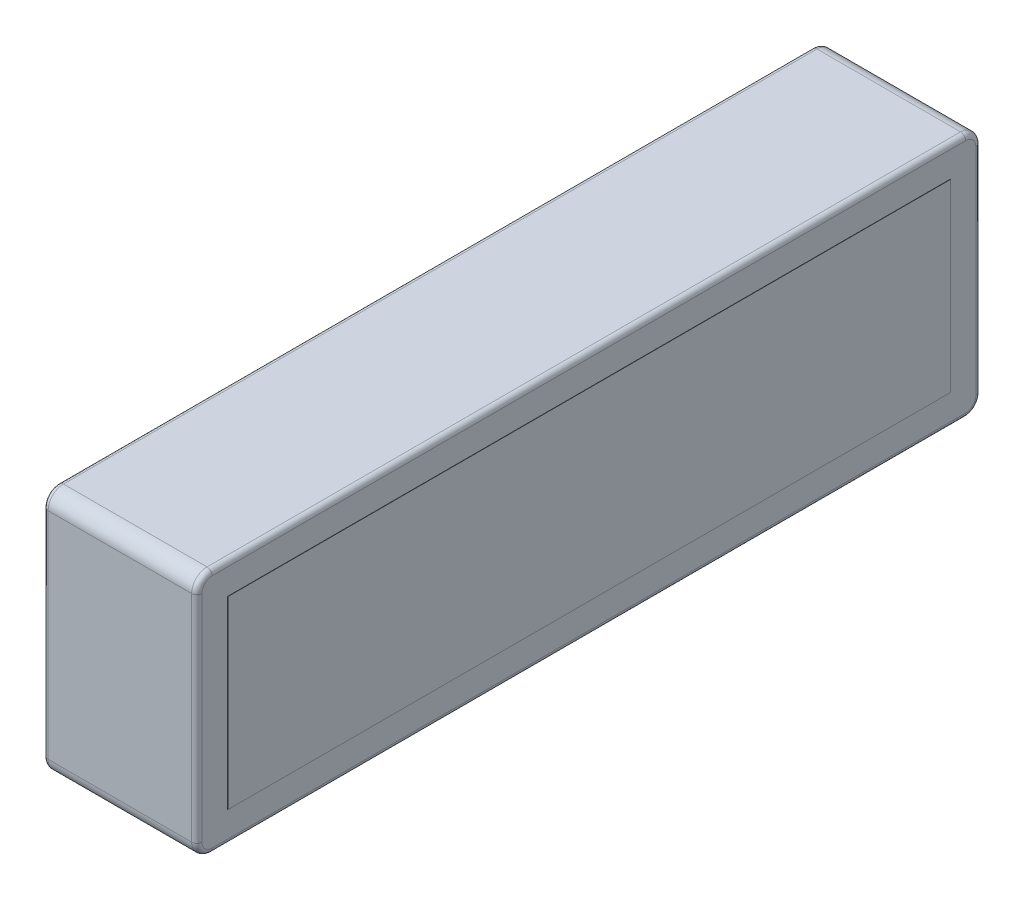
from build123d import *

# Parameters (mm, degrees)
SKETCH1_W           = 30
SKETCH1_H           = 48
BOSS_EXTRUDE1_DEPTH = 153
FILLET1_R           = 3
FILLET2_R           = 1
SKETCH2_W           = 141
SKETCH2_H           = 36
BOSS_EXTRUDE2_DEPTH = 0.05


with BuildPart() as part:
    # Sketch1 → Boss-Extrude1 (new body)
    with BuildSketch(Plane.XY):
        Rectangle(SKETCH1_W, SKETCH1_H)
    extrude(amount=BOSS_EXTRUDE1_DEPTH)

    # Fillet1
    fillet1_edges = [part.edges().sort_by_distance(p)[0] for p in [
        (0, -24, 153),
        (0, -24, 0),
        (0, 24, 0),
        (0, 24, 153),
    ]]
    fillet(fillet1_edges, radius=FILLET1_R)

    # Fillet2
    fillet2_edges = [part.edges().sort_by_distance(p)[0] for p in [
        (15, 0, 153),
        (-15, 0, 153),
        (15, 0, 0),
        (15, 24, 76.5),
        (15, -24, 76.5),
        (15, 23.121320344, 152.121320344),
        (15, 23.121320344, 0.878679656),
        (15, -23.121320344, 0.878679656),
        (15, -23.121320344, 152.121320344),
        (-15, -24, 76.5),
        (-15, 0, 0),
        (-15, 24, 76.5),
        (-15, 23.121320344, 152.121320344),
        (-15, 23.121320344, 0.878679656),
        (-15, -23.121320344, 0.878679656),
        (-15, -23.121320344, 152.121320344),
    ]]
    fillet(fillet2_edges, radius=FILLET2_R)

    # Sketch2 → Boss-Extrude2 (add)
    with BuildSketch(Plane.ZY.offset(15)):
        with Locations((76.5, 0)):
            Rectangle(SKETCH2_W, SKETCH2_H)
    boss_extrude2 = extrude(amount=BOSS_EXTRUDE2_DEPTH)

    # Mirror1: Boss-Extrude2 across plane
    add(boss_extrude2.mirror(Plane(origin=(0, 0, 0), x_dir=(0, 0, 1), z_dir=(1, 0, 0))))


solid = part.part
